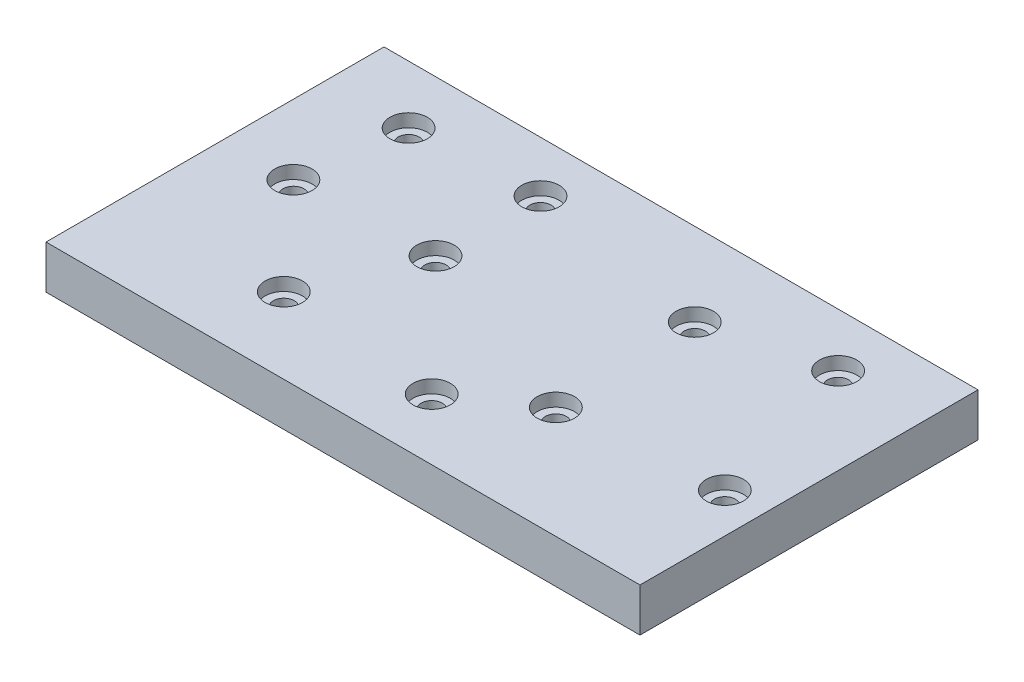
from build123d import *

# Parameters (mm, degrees)
SKETCH1_W           = 136.711090248
SKETCH1_H           = 77.79453909
BOSS_EXTRUDE1_DEPTH = 10
SKETCH2_R           = 2.416271905
CUT_EXTRUDE1_DEPTH  = 10
SKETCH3_R           = 4.303274805
CUT_EXTRUDE2_DEPTH  = 3


with BuildPart() as part:
    # Sketch1 → Boss-Extrude1 (new body)
    with BuildSketch(Plane(origin=(0, 0, 0), x_dir=(1, 0, 0), z_dir=(0, 1, 0))):
        Rectangle(SKETCH1_W, SKETCH1_H)
    extrude(amount=BOSS_EXTRUDE1_DEPTH)

    # Sketch2 → Cut-Extrude1 (cut)
    with BuildSketch(Plane(origin=(0, 10, 0), x_dir=(1, 0, 0), z_dir=(0, 1, 0))):
        with Locations(Location((-49.353103883, 25.56048813, 0), (0, 0, 270))):
            Circle(SKETCH2_R)
    cut_extrude1 = extrude(amount=-CUT_EXTRUDE1_DEPTH, mode=Mode.SUBTRACT)

    # Sketch3 → Cut-Extrude2 (cut)
    with BuildSketch(Plane(origin=(0, 10, 0), x_dir=(1, 0, 0), z_dir=(0, 1, 0))):
        with Locations(Location((-49.353103883, 25.56048813, 0), (0, 0, 270))):
            Circle(SKETCH3_R)
    cut_extrude2 = extrude(amount=-CUT_EXTRUDE2_DEPTH, mode=Mode.SUBTRACT)

    # Sketch-Pattern1: Cut-Extrude1, Cut-Extrude2 at 9 more places
    with Locations((71.598831, 0, 5.745585), (72.63009, 0, 38.74587), (28.727926, 0, -1.62055), (-2.946454, 0, 23.571632), (18.268015, 0, 46.995941), (97.822272, 0, -1.031259), (108.576829, 0, 35.799416), (28.580603, 0, 22.39305), (55.68798, 0, 50.384363)):
        add(cut_extrude1, mode=Mode.SUBTRACT)
        add(cut_extrude2, mode=Mode.SUBTRACT)


solid = part.part
